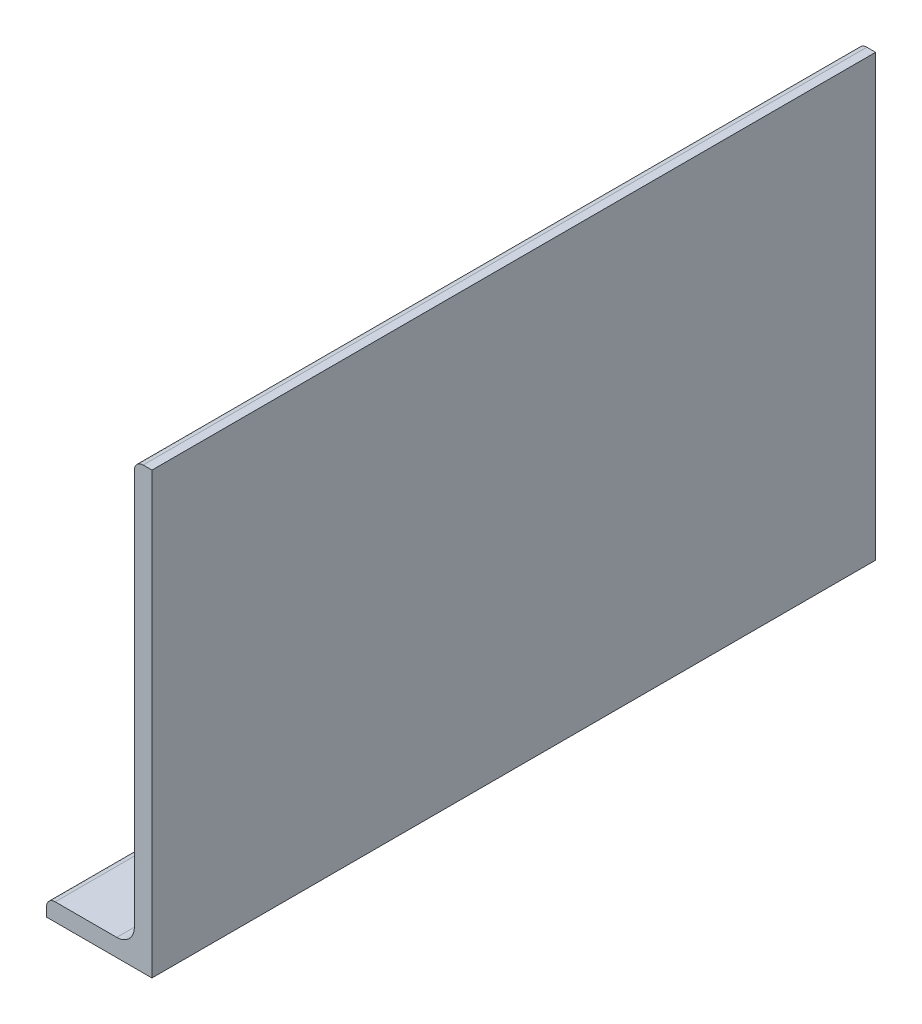
from build123d import *

# Parameters (mm, degrees)
BOSS_EXTRUDE1_DEPTH = 82.26
FILLET1_R           = 1
FILLET2_R           = 2
SKETCH2_R           = 1.6
CUT_EXTRUDE1_DEPTH  = 479.330518547


with BuildPart() as part:
    # Sketch1 → Boss-Extrude1 (new body)
    with BuildSketch(Plane.XY):
        Polygon((468.753002522, -2.512215309), (468.753002522, -52.512215309), (456.753002522, -52.512215309), (456.753002522, -50.512215309), (466.753002522, -50.512215309), (466.753002522, -2.512215309), align=None)
    extrude(amount=BOSS_EXTRUDE1_DEPTH)

    # Fillet1
    fillet1_edges = [part.edges().sort_by_distance(p)[0] for p in [
        (456.753002522, -50.512215309, 41.13),
        (466.753002522, -2.512215309, 41.13),
    ]]
    fillet(fillet1_edges, radius=FILLET1_R)

    # Fillet2
    fillet2_edges = [part.edges().sort_by_distance(p)[0] for p in [
        (466.753002522, -50.512215309, 41.13),
    ]]
    fillet(fillet2_edges, radius=FILLET2_R)

    # Sketch2 → Cut-Extrude1 (cut, through all)
    with BuildSketch(Plane(origin=(0, -50.512215309, 0), x_dir=(1, 0, 0), z_dir=(0, 1, 0))):
        with Locations(Location((461.253002522, -67.26, 0), (0, 0, 270))):
            Circle(SKETCH2_R)
        with Locations(Location((461.253002522, -15, 0), (0, 0, 270))):
            Circle(SKETCH2_R)
    extrude(amount=-CUT_EXTRUDE1_DEPTH, mode=Mode.SUBTRACT)


solid = part.part
